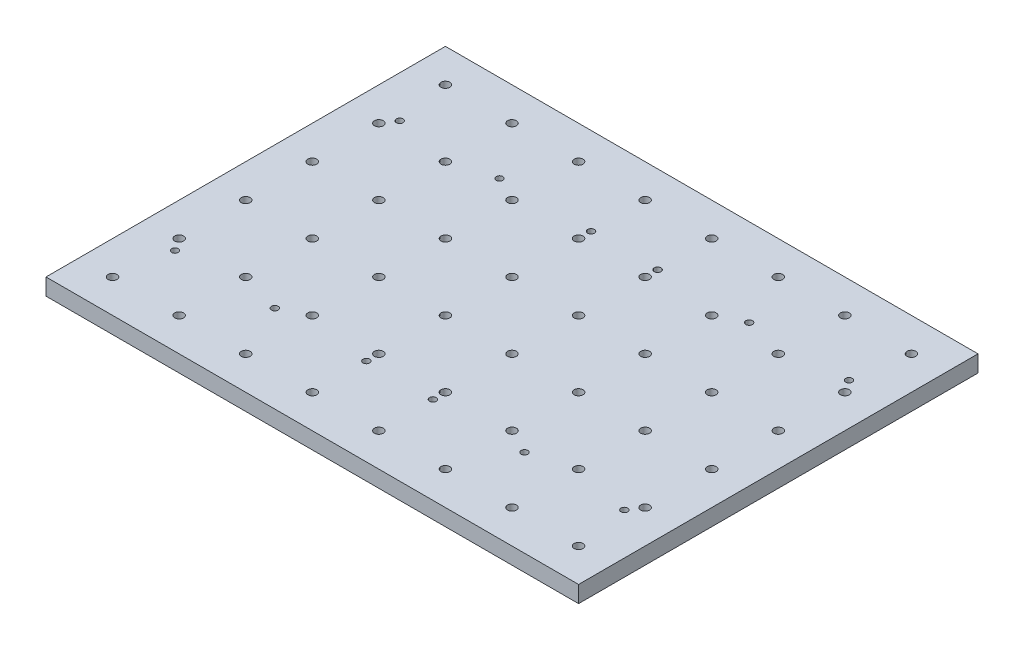
from build123d import *

# Parameters (mm, degrees)
SKETCH2_W               = 406.4
SKETCH2_H               = 304.8
BOSS_EXTRUDE1_DEPTH     = 12.7
F_1_4_CLEARANCE_HOLE1_D = 6.7564
LPATTERN1_COUNT         = 6
LPATTERN1_PITCH         = 50.8
LPATTERN1_COUNT_DIR2    = 8
LPATTERN1_PITCH_DIR2    = 50.8
F_1_4_20_TAPPED_HOLE1_D = 5.1054
MIRROR2_COPY_1_D        = 5.1054


with BuildPart() as part:
    # Sketch2 → Boss-Extrude1 (new body)
    with BuildSketch(Plane(origin=(0, 0, 0), x_dir=(1, 0, 0), z_dir=(0, 1, 0))):
        Rectangle(SKETCH2_W, SKETCH2_H)
    extrude(amount=BOSS_EXTRUDE1_DEPTH)

    # 1/4 Clearance Hole1 (through all)
    with Locations(Plane(origin=(0, 12.7, 0), x_dir=(1, 0, 0), z_dir=(0, 1, 0))):
        with Locations((-177.8, -127)):
            f_1_4_clearance_hole1 = Hole(F_1_4_CLEARANCE_HOLE1_D / 2)

    # LPattern1: 1_4 Clearance Hole1 6 × 8
    with Locations(*[(j * LPATTERN1_PITCH_DIR2, 0, -i * LPATTERN1_PITCH) for i in range(LPATTERN1_COUNT) for j in range(LPATTERN1_COUNT_DIR2) if (i, j) != (0, 0)]):
        add(f_1_4_clearance_hole1, mode=Mode.SUBTRACT)

    # 1/4-20 Tapped Hole1 (through all)
    with Locations(Plane(origin=(0, 12.7, 0), x_dir=(1, 0, 0), z_dir=(0, 1, 0))):
        with Locations((-25.4, -85.725), (-95.25, -85.725), (-171.45, -85.725)):
            f_1_4_20_tapped_hole1 = Hole(F_1_4_20_TAPPED_HOLE1_D / 2)

    # Mirror1: 1/4-20 Tapped Hole1 across plane
    add(f_1_4_20_tapped_hole1.mirror(Plane.XY), mode=Mode.SUBTRACT)

    # Mirror2: 1/4-20 Tapped Hole1 across plane
    add(f_1_4_20_tapped_hole1.mirror(Plane(origin=(0, 0, 0), x_dir=(0, 0, 1), z_dir=(1, 0, 0))), mode=Mode.SUBTRACT)

    # Mirror2 copy 1 (through all)
    with Locations(Plane(origin=(0, 12.7, 0), x_dir=(-1, 0, 0), z_dir=(0, 1, 0))):
        with Locations((-25.4, -85.725), (-95.25, -85.725), (-171.45, -85.725)):
            Hole(MIRROR2_COPY_1_D / 2)


solid = part.part
